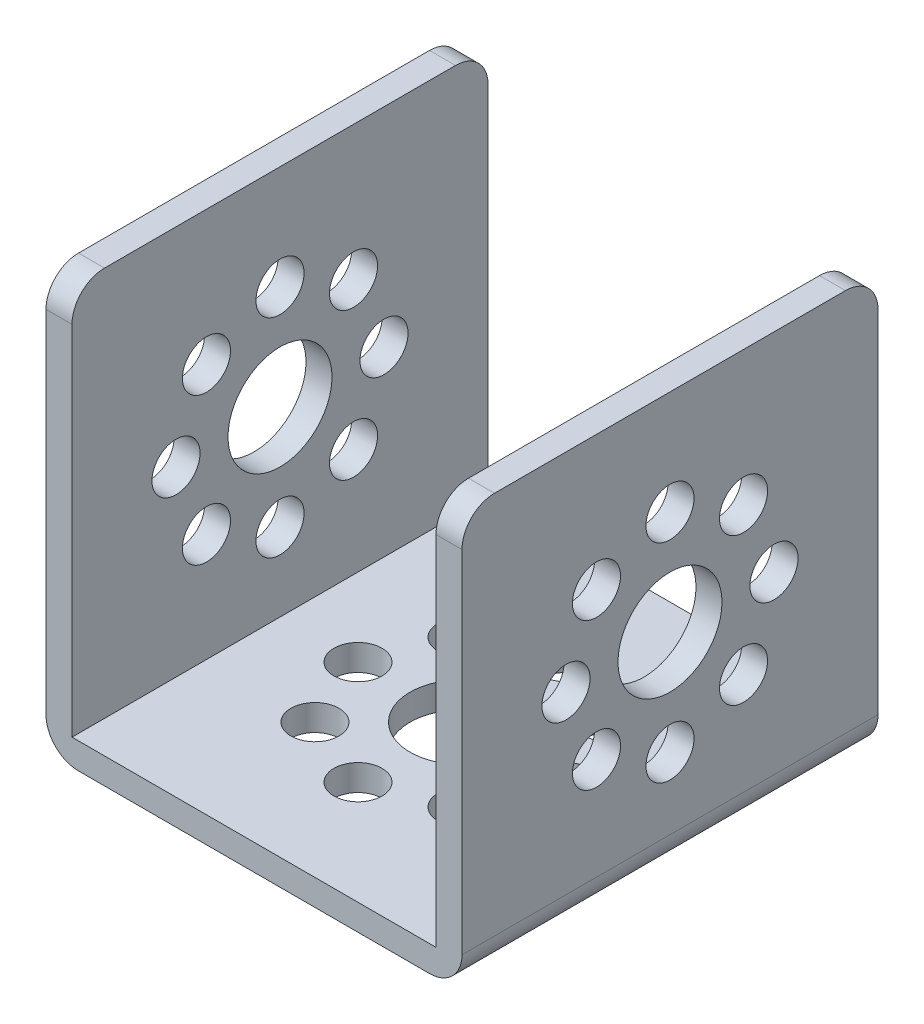
from build123d import *

# Parameters (mm, degrees)
SKETCH1_W                      = 32
SKETCH1_H                      = 32
BOSS_EXTRUDE1_DEPTH            = 32
SKETCH2_W                      = 28
SKETCH2_H                      = 30
CUT_EXTRUDE1_DEPTH             = 49
F_8_0_8_DIAMETER_HOLE1_D       = 8
F_8_0_8_DIAMETER_HOLE1_DEPTH   = 2
F_3_7_3_7_DIAMETER_HOLE1_D     = 3.7
F_3_7_3_7_DIAMETER_HOLE1_DEPTH = 2
F_3_7_3_7_DIAMETER_HOLE2_D     = 3.7
F_8_0_8_DIAMETER_HOLE2_D       = 8
F_8_0_8_DIAMETER_HOLE2_DEPTH   = 32
F_8_0_8_DIAMETER_HOLE3_D       = 8
F_8_0_8_DIAMETER_HOLE3_DEPTH   = 32
F_3_7_3_7_DIAMETER_HOLE3_D     = 3.7
F_3_7_3_7_DIAMETER_HOLE3_DEPTH = 32
FILLET1_R                      = 2.5


with BuildPart() as part:
    # Sketch1 → Boss-Extrude1 (new body)
    with BuildSketch(Plane(origin=(16, 0, 0), x_dir=(0, 0, -1), z_dir=(1, 0, 0))):
        with Locations((0, 16)):
            Rectangle(SKETCH1_W, SKETCH1_H)
    extrude(amount=-BOSS_EXTRUDE1_DEPTH)

    # Sketch2 → Cut-Extrude1 (cut, through all)
    with BuildSketch(Plane(origin=(0, 0, -16), x_dir=(-1, 0, 0), z_dir=(0, 0, -1))):
        with Locations((0, 17)):
            Rectangle(SKETCH2_W, SKETCH2_H)
    extrude(amount=-CUT_EXTRUDE1_DEPTH, mode=Mode.SUBTRACT)

    # Ø8.0 (8) Diameter Hole1
    with Locations(Plane.ZY.offset(16)):
        with Locations((0, 16)):
            Hole(F_8_0_8_DIAMETER_HOLE1_D / 2, depth=F_8_0_8_DIAMETER_HOLE1_DEPTH)

    # Ø3.7 (3.7) Diameter Hole1
    with Locations(Plane.ZY.offset(16)):
        with Locations((-8, 16), (0, 24), (8, 16), (0, 8), (-5.656854249, 21.656854249), (5.656854249, 21.656854249), (5.656854249, 10.343145751), (-5.656854249, 10.343145751)):
            Hole(F_3_7_3_7_DIAMETER_HOLE1_D / 2, depth=F_3_7_3_7_DIAMETER_HOLE1_DEPTH)

    # Ø3.7 (3.7) Diameter Hole2 (through all)
    with Locations(Plane(origin=(0, 2, 0), x_dir=(1, 0, 0), z_dir=(0, 1, 0))):
        with Locations((8, 0), (0, 8), (-8, 0), (0, -8), (5.656854249, 5.656854249), (-5.656854249, 5.656854249), (-5.656854249, -5.656854249), (5.656854249, -5.656854249)):
            Hole(F_3_7_3_7_DIAMETER_HOLE2_D / 2)

    # Ø8.0 (8) Diameter Hole2
    with Locations(Plane(origin=(0, 0, 0), x_dir=(-1, 0, 0), z_dir=(0, -1, 0))):
        with Locations((0, 0)):
            Hole(F_8_0_8_DIAMETER_HOLE2_D / 2, depth=F_8_0_8_DIAMETER_HOLE2_DEPTH)

    # Ø8.0 (8) Diameter Hole3
    with Locations(Plane(origin=(16, 0, 0), x_dir=(0, 0, -1), z_dir=(1, 0, 0))):
        with Locations((0, 16)):
            Hole(F_8_0_8_DIAMETER_HOLE3_D / 2, depth=F_8_0_8_DIAMETER_HOLE3_DEPTH)

    # Ø3.7 (3.7) Diameter Hole3
    with Locations(Plane(origin=(16, 0, 0), x_dir=(0, 0, -1), z_dir=(1, 0, 0))):
        with Locations((8, 16), (0, 24), (-8, 16), (0, 8), (5.656854249, 21.656854249), (-5.656854249, 21.656854249), (-5.656854249, 10.343145751), (5.656854249, 10.343145751)):
            Hole(F_3_7_3_7_DIAMETER_HOLE3_D / 2, depth=F_3_7_3_7_DIAMETER_HOLE3_DEPTH)

    # Fillet1
    fillet1_edges = [part.edges().sort_by_distance(p)[0] for p in [
        (-16, 0, 0),
        (15, 32, 16),
        (15, 32, -16),
        (16, 0, 0),
        (-15, 32, -16),
        (-15, 32, 16),
    ]]
    fillet(fillet1_edges, radius=FILLET1_R)


solid = part.part
